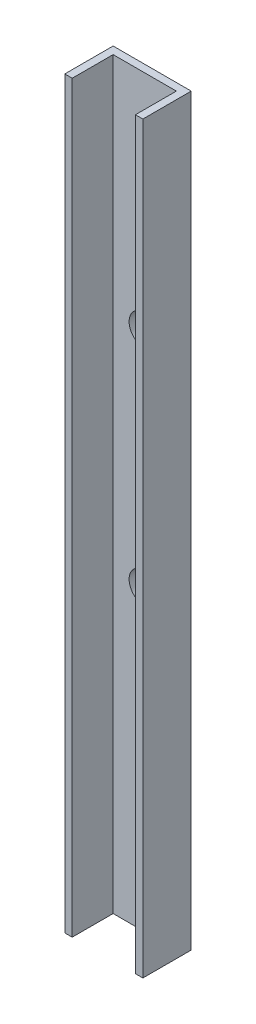
from build123d import *

# Parameters (mm, degrees)
EXTRUDE_THIN1_DEPTH = 100
SKETCH2_R           = 2.1
CUT_EXTRUDE1_DEPTH  = 10


with BuildPart() as part:
    # Sketch1 → Extrude-Thin1 (new body)
    with BuildSketch(Plane(origin=(0, 0, 0), x_dir=(1, 0, 0), z_dir=(0, 1, 0))):
        Polygon((-3.469957082, -1.813304721), (-3.469957082, 4.686695279), (7.030042918, 4.686695279), (7.030042918, -1.813304721), (6.030042918, -1.813304721), (6.030042918, 3.686695279), (-2.469957082, 3.686695279), (-2.469957082, -1.813304721), align=None)
    extrude(amount=EXTRUDE_THIN1_DEPTH)

    # Sketch2 → Cut-Extrude1 (cut)
    with BuildSketch(Plane(origin=(0, 0, -4.686695279), x_dir=(-1, 0, 0), z_dir=(0, 0, -1))):
        with Locations((-1.780042918, 70)):
            Circle(SKETCH2_R)
        with Locations((-1.780042918, 40)):
            Circle(SKETCH2_R)
    extrude(amount=-CUT_EXTRUDE1_DEPTH, mode=Mode.SUBTRACT)


solid = part.part
